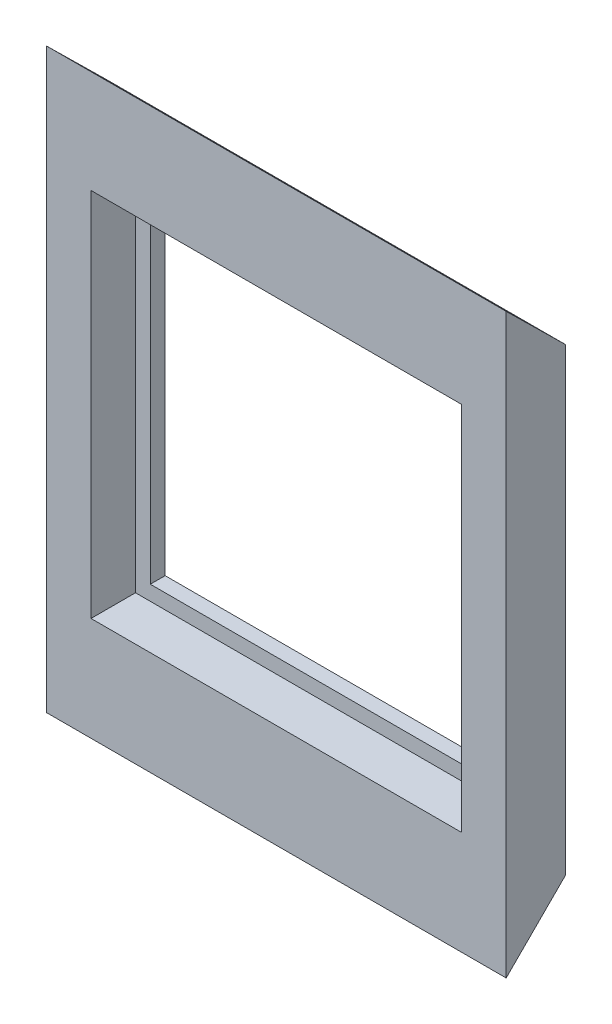
from build123d import *

# Parameters (mm, degrees)
SKETCH3_W           = 31
SKETCH3_H           = 31
BOSS_EXTRUDE2_DEPTH = 4
SKETCH4_W           = 25
SKETCH4_H           = 25
CUT_EXTRUDE1_DEPTH  = 3
SKETCH5_W           = 23
SKETCH5_H           = 23
CUT_EXTRUDE2_DEPTH  = 5


with BuildPart() as part:
    # Sketch3 → Boss-Extrude2 (new body)
    with BuildSketch(Plane.XY):
        Rectangle(SKETCH3_W, SKETCH3_H)
    extrude(amount=BOSS_EXTRUDE2_DEPTH)

    # Sketch4 → Cut-Extrude1 (cut)
    with BuildSketch(Plane.XY.offset(4)):
        Rectangle(SKETCH4_W, SKETCH4_H)
    extrude(amount=-CUT_EXTRUDE1_DEPTH, mode=Mode.SUBTRACT)

    # Sketch5 → Cut-Extrude2 (cut)
    with BuildSketch(Plane.XY.offset(1)):
        Rectangle(SKETCH5_W, SKETCH5_H)
    extrude(amount=-CUT_EXTRUDE2_DEPTH, mode=Mode.SUBTRACT)

    # Sweep1: sweep along a curve in space
    with BuildLine() as sweep1_path:
        Line((-15.5, -15.5, 4), (15.5, -15.5, 4))
    # Sketch6 → Sweep1 (sweep)
    with BuildSketch(Plane.ZY.offset(15.5)):
        Polygon((4, -15.5), (4, -19.5), (0, -15.5), align=None)
    sweep(path=sweep1_path.line)

    # Sweep2: sweep along a curve in space
    with BuildLine() as sweep2_path:
        Line((15.5, 15.5, 0), (-15.5, 15.5, 0))
    # Sketch8 → Sweep2 (sweep)
    with BuildSketch(Plane.ZY.offset(15.5)):
        Polygon((0, 15.5), (4, 19.43634716), (4, 15.5), align=None)
    sweep(path=sweep2_path.line)


solid = part.part
